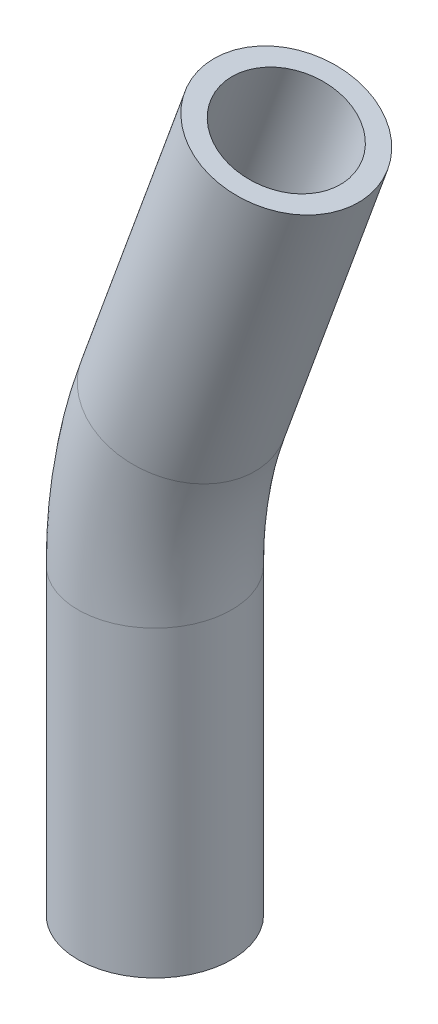
from build123d import *

# Parameters (mm, degrees)
SKETCH2_R   = 4
SKETCH2_R_2 = 3


with BuildPart() as part:
    # Sweep1: sweep along a path in Sketch1
    with BuildLine(Plane.XY) as sweep1_path:
        Line((0, 0), (0, 15.768152463))
        ThreePointArc((0, 15.768152463), (0.364613928, 19.935708727), (1.447377101, 23.976635903))
        Line((1.447377101, 23.976635903), (6.840402867, 38.793852416))
    # Sketch2 → Sweep1 (sweep)
    with BuildSketch(Plane(origin=(0, 0, 0), x_dir=(1, 0, 0), z_dir=(0, 1, 0))):
        Circle(SKETCH2_R)
        Circle(SKETCH2_R_2, mode=Mode.SUBTRACT)
    sweep(path=sweep1_path.line)


solid = part.part
